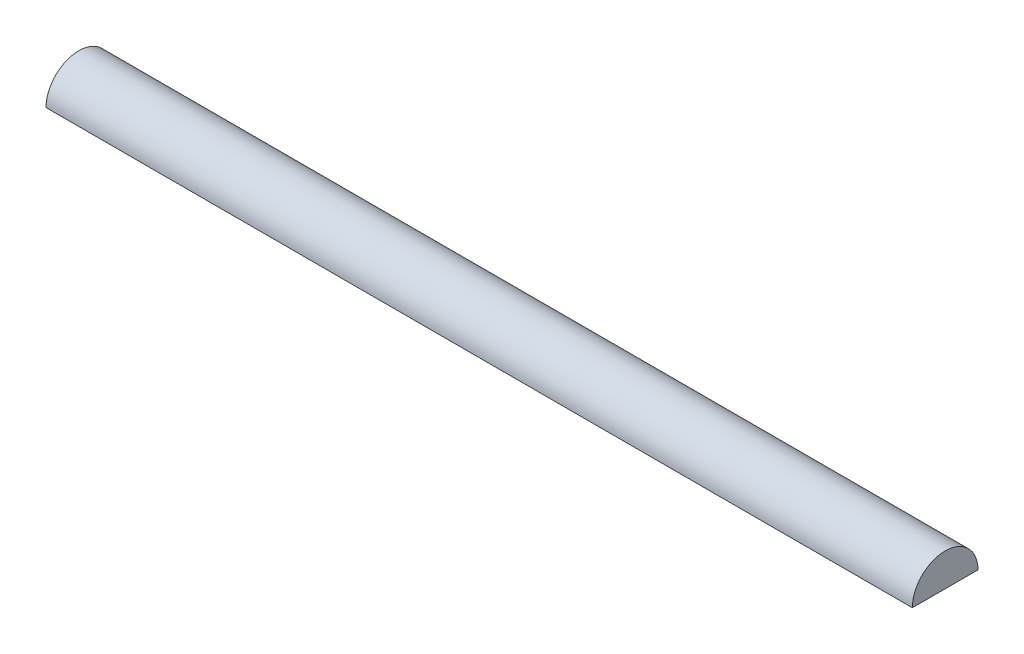
from build123d import *

# Parameters (mm, degrees)
BOSS_EXTRUDE1_DEPTH      = 5000
BOSS_EXTRUDE1_DEPTH_BACK = 15000
SKETCH2_R                = 757.99738402
SKETCH3_W                = 22982.636608486
SKETCH3_H                = 3639.943339499
CUT_EXTRUDE1_DEPTH       = 15039.255220216


with BuildPart() as part:
    # Sketch1 → Revolve1 (revolve)
    with BuildSketch(Plane(origin=(0, 0, 0), x_dir=(-1, 0, 0), z_dir=(0, 1, 0)), mode=Mode.PRIVATE) as revolve1_sk:
        Polygon((2668.016049341, 619.375942877), (1757.185045246, 174.768523987), (2679.161981208, 350), (2679.161981208, 0), (5679.161981208, 0), (5679.161981208, 497.012889954), (6957.851062661, 497.012889954), (6405.608884025, 619.375942877), align=None)
    revolve(revolve1_sk.sketch.rotate(Axis((-2679.161981208, 0, 0), (-1, 0, 0)), 180), axis=Axis((-2679.161981208, 0, 0), (-1, 0, 0)))


with BuildPart() as body_2:
    # Sketch2 → Boss-Extrude1 (new, two sides: drawn at the far end of the back side and taken through both)
    with BuildSketch(Plane(origin=(0, 0, 0), x_dir=(0, 0, -1), z_dir=(1, 0, 0)).offset(-BOSS_EXTRUDE1_DEPTH_BACK)):
        Circle(SKETCH2_R)
    extrude(amount=BOSS_EXTRUDE1_DEPTH + BOSS_EXTRUDE1_DEPTH_BACK)

    # Combine1: cut part
    add(part.part, mode=Mode.SUBTRACT)

    # Sketch3 → Cut-Extrude1 (cut, through all)
    with BuildSketch(Plane(origin=(0, 0, 0), x_dir=(-1, 0, 0), z_dir=(0, 1, 0))):
        with Locations((5164.892884317, 260.380744392)):
            Rectangle(SKETCH3_W, SKETCH3_H)
    extrude(amount=-CUT_EXTRUDE1_DEPTH, mode=Mode.SUBTRACT)


solid = body_2.part
